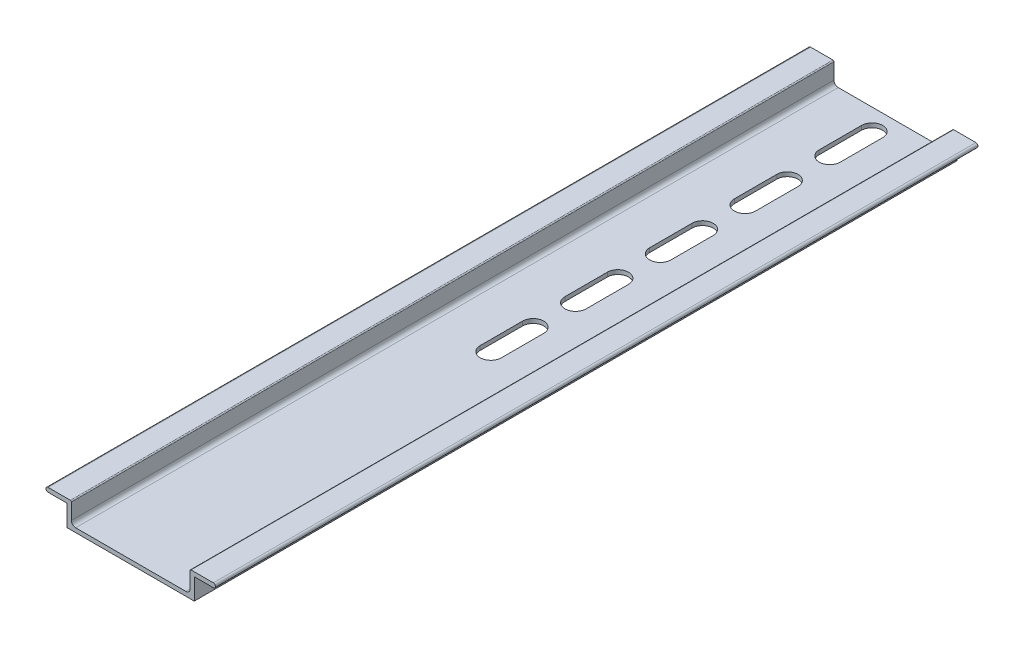
from build123d import *

# Parameters (mm, degrees)
EXTRUDE_THIN1_DEPTH = 90
FILLET1_R           = 1
FILLET2_R           = 0.25
FILLET3_RADIUS      = 0.5
FILLET3_LENGTH      = 180
FILLET4_RADIUS      = 0.5
FILLET4_LENGTH      = 180
CUT_EXTRUDE1_DEPTH  = 93.330926563
LPATTERN1_COUNT     = 5
LPATTERN1_PITCH     = 20


with BuildPart() as part:
    # Sketch1 → Extrude-Thin1 (new, symmetric)
    with BuildSketch(Plane.XY):
        Polygon((-20, 5), (-15, 5), (-15, 0), (15, 0), (15, 5), (20, 5), (20, 6), (14, 6), (14, 1), (-14, 1), (-14, 6), (-20, 6), align=None)
    extrude(amount=EXTRUDE_THIN1_DEPTH, both=True)

    # Fillet1
    fillet1_edges = [part.edges().sort_by_distance(p)[0] for p in [
        (-14, 1, 0),
        (14, 1, 0),
    ]]
    fillet(fillet1_edges, radius=FILLET1_R)

    # Fillet2
    fillet2_edges = [part.edges().sort_by_distance(p)[0] for p in [
        (-14, 6, 0),
        (14, 6, 0),
    ]]
    fillet(fillet2_edges, radius=FILLET2_R)

    # Fillet3: full round fillet: the end face becomes a half cylinder, R = half its width
    fillet3_face = Plane((20, 5.5, 0), x_dir=(0, 0, 1), z_dir=(1, 0, 0))  # on the end face: x along it, z out of the body
    fillet3_slab = fillet3_face.offset(-FILLET3_RADIUS / 2) * Box(FILLET3_LENGTH, 2 * FILLET3_RADIUS, FILLET3_RADIUS, mode=Mode.PRIVATE)  # the body's end, R deep
    fillet3_round = Plane((19.5, 5.5, 0), x_dir=(1, 0, 0), z_dir=(0, 0, 1)) * Cylinder(FILLET3_RADIUS, FILLET3_LENGTH, mode=Mode.PRIVATE)  # its axis R under the face
    add(fillet3_slab - fillet3_round, mode=Mode.SUBTRACT)

    # Fillet4: full round fillet: the end face becomes a half cylinder, R = half its width
    fillet4_face = Plane((-20, 5.5, 0), x_dir=(0, 0, 1), z_dir=(-1, 0, 0))  # on the end face: x along it, z out of the body
    fillet4_slab = fillet4_face.offset(-FILLET4_RADIUS / 2) * Box(FILLET4_LENGTH, 2 * FILLET4_RADIUS, FILLET4_RADIUS, mode=Mode.PRIVATE)  # the body's end, R deep
    fillet4_round = Plane((-19.5, 5.5, 0), x_dir=(-1, 0, 0), z_dir=(0, 0, 1)) * Cylinder(FILLET4_RADIUS, FILLET4_LENGTH, mode=Mode.PRIVATE)  # its axis R under the face
    add(fillet4_slab - fillet4_round, mode=Mode.SUBTRACT)

    # Sketch2 → Cut-Extrude1 (cut, through all)
    with BuildSketch(Plane(origin=(0, 1, 0), x_dir=(1, 0, 0), z_dir=(0, 1, 0))):
        with BuildLine():
            Line((-2.5, -5), (-2.5, 5))
            ThreePointArc((-2.5, 5), (0, 7.5), (2.5, 5))
            Line((2.5, 5), (2.5, -5))
            ThreePointArc((2.5, -5), (0, -7.5), (-2.5, -5))
        make_face()
    cut_extrude1 = extrude(amount=-CUT_EXTRUDE1_DEPTH, mode=Mode.SUBTRACT)

    # LPattern1: Cut-Extrude1 ×5
    with Locations(*[(0, 0, -i * LPATTERN1_PITCH) for i in range(1, LPATTERN1_COUNT)]):
        add(cut_extrude1, mode=Mode.SUBTRACT)


solid = part.part
